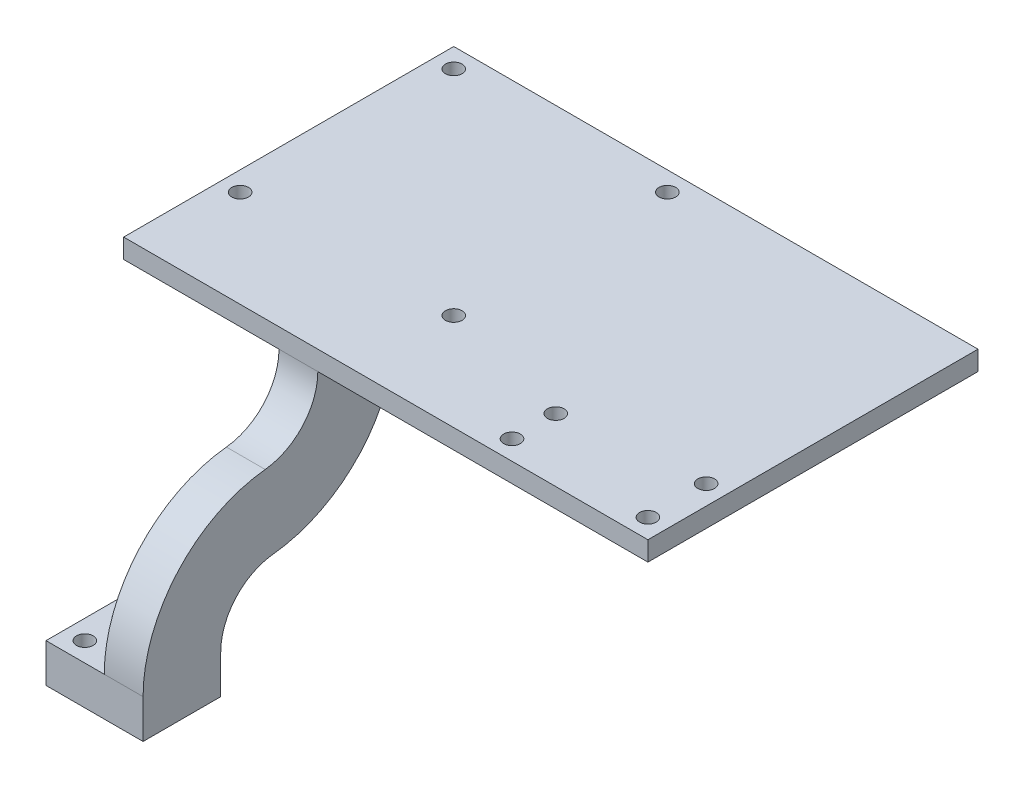
from build123d import *

# Parameters (mm, degrees)
BOSS_EXTRUDE1_DEPTH   = 10
SKETCH2_W             = 20
SKETCH2_H             = 10
BOSS_EXTRUDE2_DEPTH   = 25
F_6_CLEARANCE_HOLE1_D = 4.3053
SKETCH5_W             = 135
SKETCH5_H             = 85
BOSS_EXTRUDE3_DEPTH   = 5
F_6_CLEARANCE_HOLE2_D = 4.3053
F_6_CLEARANCE_HOLE3_D = 4.3053


with BuildPart() as part:
    # Sketch1 → Boss-Extrude1 (new body)
    with BuildSketch(Plane(origin=(0, 0, 0), x_dir=(0, 0, -1), z_dir=(1, 0, 0))):
        with BuildLine():
            Line((-10, 0), (-10, -10))
            Line((-10, -10), (10, -10))
            Line((10, -10), (10, 0))
            ThreePointArc((10, 0), (13.886241397, 10.127382743), (23.549723757, 15.055248619))
            ThreePointArc((23.549723757, 15.055248619), (45.979641528, 26.493322625), (55, 50))
            Line((55, 50), (35, 50))
            ThreePointArc((35, 50), (31.113758603, 39.872617257), (21.450276243, 34.944751381))
            ThreePointArc((21.450276243, 34.944751381), (-0.979641528, 23.506677375), (-10, 0))
        make_face()
    extrude(amount=BOSS_EXTRUDE1_DEPTH)

    # Sketch2 → Boss-Extrude2 (add)
    with BuildSketch(Plane(origin=(10, 0, 0), x_dir=(0, 0, -1), z_dir=(1, 0, 0))):
        with Locations((0, -5)):
            Rectangle(SKETCH2_W, SKETCH2_H)
    extrude(amount=-BOSS_EXTRUDE2_DEPTH)

    # #6 Clearance Hole1 (through all)
    with Locations(Plane(origin=(0, 0, 0), x_dir=(1, 0, 0), z_dir=(0, 1, 0))):
        with Locations((-10, 5), (-10, -5)):
            Hole(F_6_CLEARANCE_HOLE1_D / 2)

    # Sketch5 → Boss-Extrude3 (add)
    with BuildSketch(Plane(origin=(0, 50, 0), x_dir=(1, 0, 0), z_dir=(0, 1, 0))):
        with Locations((27.5, 77.5)):
            Rectangle(SKETCH5_W, SKETCH5_H)
    extrude(amount=BOSS_EXTRUDE3_DEPTH)

    # #6 Clearance Hole2 (through all)
    with Locations(Plane(origin=(0, 55, 0), x_dir=(1, 0, 0), z_dir=(0, 1, 0))):
        with Locations((20, 115), (20, 60), (-35, 60), (-35, 115)):
            Hole(F_6_CLEARANCE_HOLE2_D / 2)

    # #6 Clearance Hole3 (through all)
    with Locations(Plane(origin=(0, 55, 0), x_dir=(1, 0, 0), z_dir=(0, 1, 0))):
        with Locations((90, 40), (55, 40), (55, 51.266063414), (90, 55)):
            Hole(F_6_CLEARANCE_HOLE3_D / 2)


solid = part.part
